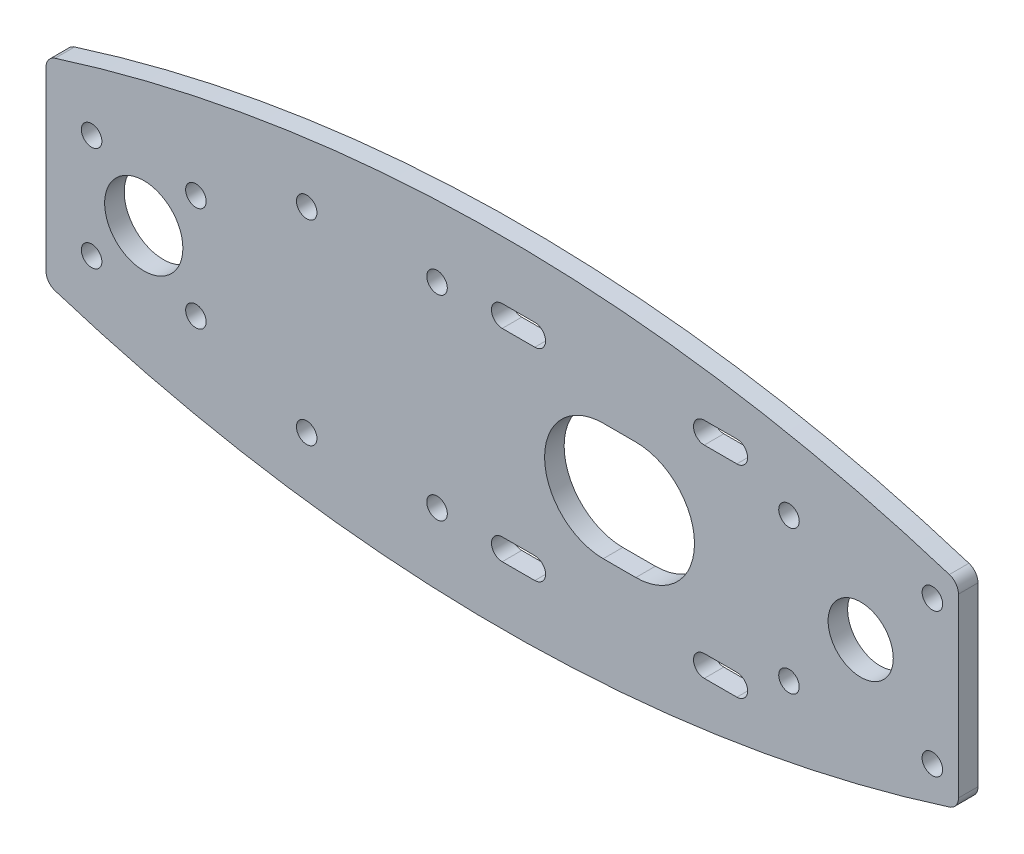
from build123d import *

# Parameters (mm, degrees)
MODEL_R         = 5
MODEL_R_2       = 6
MODEL_R_3       = 1.575
EXTRUDE_1_DEPTH = 3


with BuildPart() as part:
    # Model → 凸台-拉伸1 (new body)
    with BuildSketch(Plane.XY):
        with BuildLine():
            Line((-88, 13.542891419), (-88, -13.542891419))
            ThreePointArc((-88, -13.542891419), (-87.614574011, -14.723209496), (-86.606849237, -15.448602311))
            ThreePointArc((-86.606849237, -15.448602311), (-18, -26.108381092), (50.606849237, -15.448602311))
            ThreePointArc((50.606849237, -15.448602311), (51.614574011, -14.723209496), (52, -13.542891419))
            Line((52, -13.542891419), (52, 13.542891419))
            ThreePointArc((52, 13.542891419), (51.614574011, 14.723209496), (50.606849237, 15.448602311))
            ThreePointArc((50.606849237, 15.448602311), (-18, 26.108381092), (-86.606849237, 15.448602311))
            ThreePointArc((-86.606849237, 15.448602311), (-87.614574011, 14.723209496), (-88, 13.542891419))
        make_face()
        with Locations((37, 0)):
            Circle(MODEL_R, mode=Mode.SUBTRACT)
        with Locations((-73, 0)):
            Circle(MODEL_R_2, mode=Mode.SUBTRACT)
        with Locations((26, 11)):
            Circle(MODEL_R_3, mode=Mode.SUBTRACT)
        with Locations((48, 11)):
            Circle(MODEL_R_3, mode=Mode.SUBTRACT)
        with Locations((48, -11)):
            Circle(MODEL_R_3, mode=Mode.SUBTRACT)
        with Locations((26, -11)):
            Circle(MODEL_R_3, mode=Mode.SUBTRACT)
        with Locations((-81, 8)):
            Circle(MODEL_R_3, mode=Mode.SUBTRACT)
        with Locations((-65, 8)):
            Circle(MODEL_R_3, mode=Mode.SUBTRACT)
        with Locations((-65, -8)):
            Circle(MODEL_R_3, mode=Mode.SUBTRACT)
        with Locations((-81, -8)):
            Circle(MODEL_R_3, mode=Mode.SUBTRACT)
        with Locations((-28, 15)):
            Circle(MODEL_R_3, mode=Mode.SUBTRACT)
        with Locations((-28, -15)):
            Circle(MODEL_R_3, mode=Mode.SUBTRACT)
        with Locations((-48, -15)):
            Circle(MODEL_R_3, mode=Mode.SUBTRACT)
        with Locations((-48, 15)):
            Circle(MODEL_R_3, mode=Mode.SUBTRACT)
        with BuildLine():
            Line((2.5, 9), (-2.5, 9))
            ThreePointArc((-2.5, 9), (-11.5, 0), (-2.5, -9))
            Line((-2.5, -9), (2.5, -9))
            ThreePointArc((2.5, -9), (11.5, 0), (2.5, 9))
        make_face(mode=Mode.SUBTRACT)
        with BuildLine():
            Line((-13, 17.15), (-18, 17.15))
            ThreePointArc((-18, 17.15), (-19.65, 15.5), (-18, 13.85))
            Line((-18, 13.85), (-13, 13.85))
            ThreePointArc((-13, 13.85), (-11.35, 15.5), (-13, 17.15))
        make_face(mode=Mode.SUBTRACT)
        with BuildLine():
            Line((18, 17.15), (13, 17.15))
            ThreePointArc((13, 17.15), (11.35, 15.5), (13, 13.85))
            Line((13, 13.85), (18, 13.85))
            ThreePointArc((18, 13.85), (19.65, 15.5), (18, 17.15))
        make_face(mode=Mode.SUBTRACT)
        with BuildLine():
            Line((13, -17.15), (18, -17.15))
            ThreePointArc((18, -17.15), (19.65, -15.5), (18, -13.85))
            Line((18, -13.85), (13, -13.85))
            ThreePointArc((13, -13.85), (11.35, -15.5), (13, -17.15))
        make_face(mode=Mode.SUBTRACT)
        with BuildLine():
            Line((-13, -13.85), (-18, -13.85))
            ThreePointArc((-18, -13.85), (-19.65, -15.5), (-18, -17.15))
            Line((-18, -17.15), (-13, -17.15))
            ThreePointArc((-13, -17.15), (-11.35, -15.5), (-13, -13.85))
        make_face(mode=Mode.SUBTRACT)
    extrude(amount=EXTRUDE_1_DEPTH)


solid = part.part
